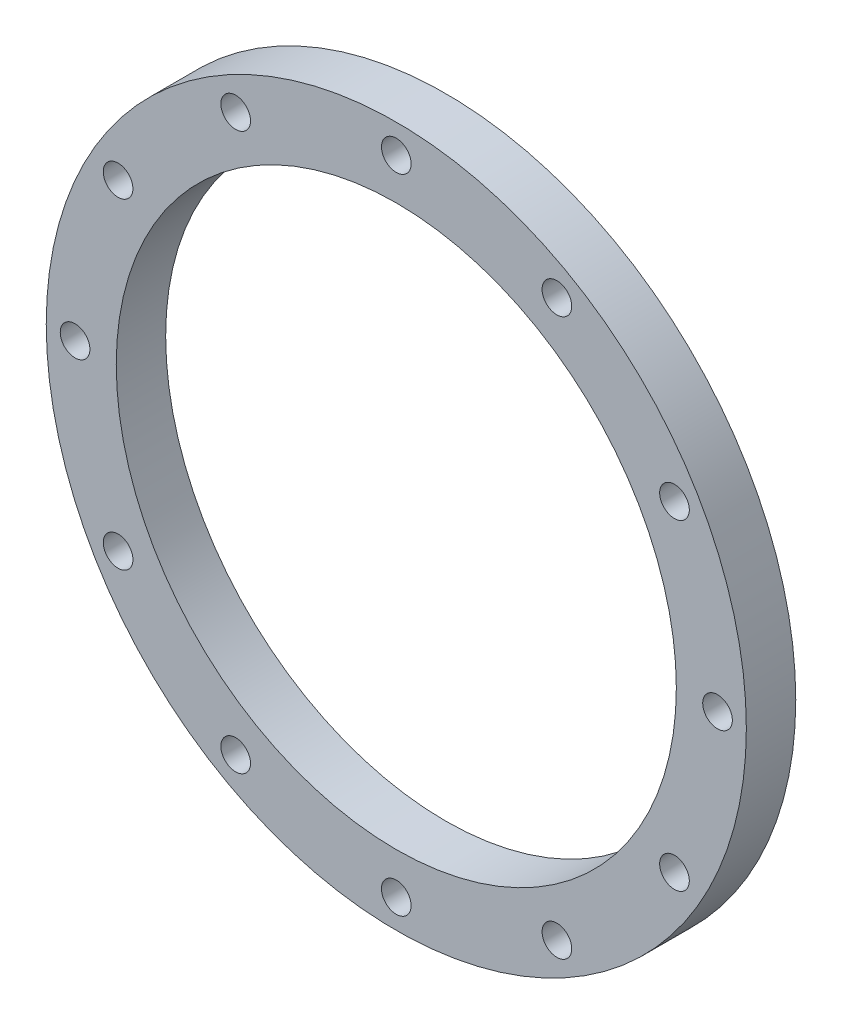
from build123d import *

# Parameters (mm, degrees)
SKETCH_1_R                = 42.5
SKETCH_1_R_2              = 34
EXTRUDE_1_DEPTH           = 6
HOLE_WIZARD_1_D           = 3.6
HOLE_WIZARD_1_CBORE_D     = 6
HOLE_WIZARD_1_CBORE_DEPTH = 3.4
PATTERN_CIRCULAR_1_COUNT  = 12


with BuildPart() as part:
    # 草图1 → 凸台-拉伸1 (new body)
    with BuildSketch(Plane.XY):
        Circle(SKETCH_1_R)
        Circle(SKETCH_1_R_2, mode=Mode.SUBTRACT)
    extrude(amount=EXTRUDE_1_DEPTH)

    # 打孔尺寸(%根据)内六角圆柱头螺钉的类型1 (through all)
    with Locations(Plane(origin=(0, 0, 0), x_dir=(-1, 0, 0), z_dir=(0, 0, -1))):
        with Locations((0, 39)):
            hole_wizard_1 = CounterBoreHole(HOLE_WIZARD_1_D / 2, HOLE_WIZARD_1_CBORE_D / 2, HOLE_WIZARD_1_CBORE_DEPTH)

    # 阵列(圆周)1: 打孔尺寸(%根据)内六角圆柱头螺钉的类型1 ×12 about axis
    pattern_circular_1_axis = Axis((0, 0, 6), (0, 0, -1))
    for i in range(1, PATTERN_CIRCULAR_1_COUNT):
        add(hole_wizard_1.rotate(pattern_circular_1_axis, i * 360 / PATTERN_CIRCULAR_1_COUNT), mode=Mode.SUBTRACT)


solid = part.part
